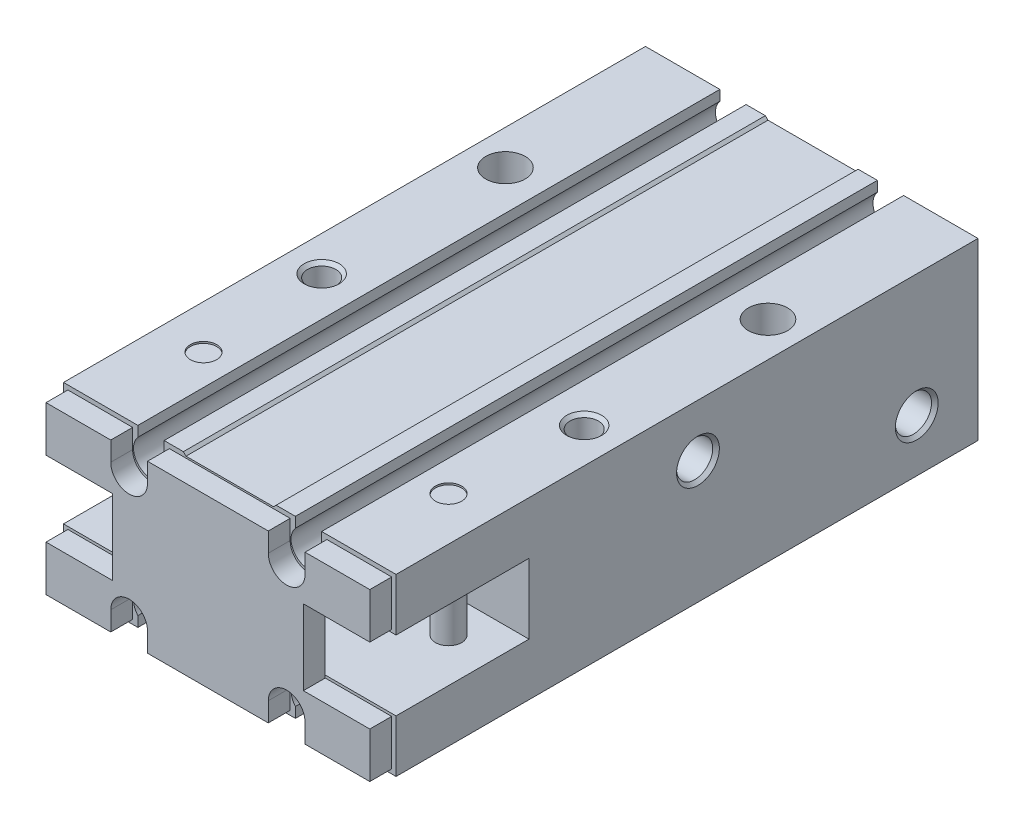
from build123d import *

# Parameters (mm, degrees)
SKETCH_1_W                  = 38
SKETCH_1_H                  = 69
EXTRUDE_1_DEPTH             = 19
CUT_EXTRUDE_1_DEPTH         = 2.5
CUT_EXTRUDE_2_REACH         = 57.533
SKETCH_4_W                  = 8.09
SKETCH_4_H                  = 8
SKETCH_5_W                  = 15.19
SKETCH_5_H                  = 8
CUT_EXTRUDE_3_DEPTH         = 7.92
SKETCH_6_W                  = 0.5
SKETCH_6_H                  = 2.5
CUT_EXTRUDE_4_DEPTH         = 75.047282192
SKETCH_7_W                  = 38
SKETCH_7_H                  = 66.5
EXTRUDE_2_DEPTH             = 0.5
SKETCH_8_W                  = 0.5
SKETCH_8_H                  = 2.5
CUT_EXTRUDE_5_DEPTH         = 73.924618614
SKETCH_9_W                  = 38
SKETCH_9_H                  = 66.5
EXTRUDE_3_DEPTH             = 0.5
SKETCH_10_W                 = 15.19
SKETCH_10_H                 = 8
CUT_EXTRUDE_6_DEPTH         = 0.5
SKETCH_11_W                 = 17.69
SKETCH_11_H                 = 8
CUT_EXTRUDE_7_DEPTH         = 7.59
SKETCH_12_W                 = 15.19
SKETCH_12_H                 = 8
CUT_EXTRUDE_8_DEPTH         = 7.92
CUT_EXTRUDE_9_REACH         = 74.983
SKETCH_13_W                 = 7.59
SKETCH_13_H                 = 2.5
SKETCH_14_W                 = 7.59
SKETCH_14_H                 = 2.5
CUT_EXTRUDE_10_DEPTH        = 0.3
CUT_EXTRUDE_11_REACH        = 74.983
SKETCH_15_W                 = 7.59
SKETCH_15_H                 = 2.5
SKETCH_16_W                 = 7.59
SKETCH_16_H                 = 2.5
CUT_EXTRUDE_12_DEPTH        = 0.3
CUT_EXTRUDE_13_DEPTH        = 2.5
CUT_EXTRUDE_14_DEPTH        = 2.5
CUT_EXTRUDE_15_DEPTH        = 2.5
CUT_EXTRUDE_16_DEPTH        = 2.5
SKETCH_21_W                 = 10
SKETCH_21_H                 = 0.3
CUT_EXTRUDE_17_DEPTH        = 70.880254722
CUT_EXTRUDE_18_DEPTH        = 70.880254722
CUT_EXTRUDE_19_DEPTH        = 73.263407061
CUT_EXTRUDE_20_DEPTH        = 73.263407061
SKETCH_25_W                 = 10
SKETCH_25_H                 = 0.3
CUT_EXTRUDE_21_DEPTH        = 66.5
CUT_EXTRUDE_22_DEPTH        = 73.263407061
CUT_EXTRUDE_23_DEPTH        = 3
DRAFT_1_ANGLE               = 45
DRAFT_2_ANGLE               = 45
SKETCH_28_W                 = 2
SKETCH_28_H                 = 66.5
SKETCH_29_W                 = 2
SKETCH_29_H                 = 66.5
SKETCH_30_W                 = 2
SKETCH_30_H                 = 66.5
SKETCH_31_W                 = 2
SKETCH_31_H                 = 66.5
SKETCH_32_W                 = 1.5
SKETCH_32_H                 = 8
SKETCH_33_W                 = 1.5
SKETCH_33_H                 = 8
HOLE_WIZARD_3_0_3_1_D       = 3
HOLE_WIZARD_3_0_3_1_DEPTH   = 0.2
HOLE_WIZARD_M3_1_D          = 3.242
HOLE_WIZARD_M3_1_DEPTH      = 8
HOLE_WIZARD_M3_1_TIP        = 0.935884786
HOLE_WIZARD_M3_2_D          = 3.242
HOLE_WIZARD_M3_2_DEPTH      = 5
HOLE_WIZARD_M3_2_TIP        = 0.935884786
HOLE_WIZARD_3_0_3_2_D       = 3
HOLE_WIZARD_3_0_3_2_DEPTH   = 0.2
HOLE_WIZARD_4_5_4_5_1_D     = 4.5
HOLE_WIZARD_M3_3_D          = 3.242
HOLE_WIZARD_M3_3_DEPTH      = 8
HOLE_WIZARD_M3_3_TIP        = 0.935884786
HOLE_WIZARD_17_0_17_1_D     = 17
HOLE_WIZARD_17_0_17_1_DEPTH = 1.5
HOLE_WIZARD_M3_4_D          = 3.242
HOLE_WIZARD_M3_4_DEPTH      = 8
HOLE_WIZARD_M3_4_TIP        = 0.935884786
HOLE_WIZARD_M3_5_1_D        = 4.134
HOLE_WIZARD_M3_5_1_DEPTH    = 5
HOLE_WIZARD_M3_5_1_TIP      = 1.193383006
CHAMFER_1_SIZE              = 0.379


with BuildPart() as part:
    # 草图1 → 凸台-拉伸1 (new body)
    with BuildSketch(Plane.XZ.offset(9.5)):
        with Locations((0, 34.5)):
            Rectangle(SKETCH_1_W, SKETCH_1_H)
    extrude(amount=-EXTRUDE_1_DEPTH)

    # 草图2 → 切除-拉伸1 (cut)
    with BuildSketch(Plane.XY.offset(69)):
        Polygon((-19, -4), (-10.91, -4), (-10.91, 4), (-18.5, 4), (-18.5, 9.5), (-19, 9.5), align=None)
    extrude(amount=-CUT_EXTRUDE_1_DEPTH, mode=Mode.SUBTRACT)

    # 草图4 → 切除-拉伸2 (cut, up to next)
    with BuildSketch(Plane(origin=(0, 0, 51.31), x_dir=(-1, 0, 0), z_dir=(0, 0, -1)), mode=Mode.PRIVATE) as cut_extrude_2_sk1:
        with Locations((14.955, 0)):
            Rectangle(SKETCH_4_W, SKETCH_4_H)
    cut_extrude_2_tool1 = extrude(cut_extrude_2_sk1.sketch, amount=-CUT_EXTRUDE_2_REACH, mode=Mode.PRIVATE) & part.part
    add(cut_extrude_2_tool1.solids().sort_by_distance((-14.955, 0, 51.31))[0], mode=Mode.SUBTRACT)

    # 草图5 → 切除-拉伸3 (cut)
    with BuildSketch(Plane.ZY.offset(10.91)):
        with Locations((58.905, 0)):
            Rectangle(SKETCH_5_W, SKETCH_5_H)
    extrude(amount=-CUT_EXTRUDE_3_DEPTH, mode=Mode.SUBTRACT)

    # 草图6 → 切除-拉伸4 (cut, through all)
    with BuildSketch(Plane.XZ.offset(9.5)):
        with Locations((18.75, 67.75)):
            Rectangle(SKETCH_6_W, SKETCH_6_H)
    extrude(amount=-CUT_EXTRUDE_4_DEPTH, mode=Mode.SUBTRACT)

    # 草图7 → 凸台-拉伸2 (add)
    with BuildSketch(Plane(origin=(0, 9.5, 0), x_dir=(-1, 0, 0), z_dir=(0, 1, 0))):
        with Locations((0, 33.25)):
            Rectangle(SKETCH_7_W, SKETCH_7_H)
    extrude(amount=EXTRUDE_2_DEPTH)

    # 草图8 → 切除-拉伸5 (cut, through all)
    with BuildSketch(Plane(origin=(0, -4, 0), x_dir=(-1, 0, 0), z_dir=(0, 1, 0))):
        with Locations((18.75, 67.75)):
            Rectangle(SKETCH_8_W, SKETCH_8_H)
    extrude(amount=-CUT_EXTRUDE_5_DEPTH, mode=Mode.SUBTRACT)

    # 草图9 → 凸台-拉伸3 (add)
    with BuildSketch(Plane.XZ.offset(9.5)):
        with Locations((0, 33.25)):
            Rectangle(SKETCH_9_W, SKETCH_9_H)
    extrude(amount=EXTRUDE_3_DEPTH)

    # 草图10 → 切除-拉伸6 (cut)
    with BuildSketch(Plane(origin=(19, 0, 0), x_dir=(0, 0, -1), z_dir=(1, 0, 0))):
        with Locations((-58.905, 0)):
            Rectangle(SKETCH_10_W, SKETCH_10_H)
    extrude(amount=-CUT_EXTRUDE_6_DEPTH, mode=Mode.SUBTRACT)

    # 草图11 → 切除-拉伸7 (cut)
    with BuildSketch(Plane(origin=(18.5, 0, 0), x_dir=(0, 0, -1), z_dir=(1, 0, 0))):
        with Locations((-60.155, 0)):
            Rectangle(SKETCH_11_W, SKETCH_11_H)
    extrude(amount=-CUT_EXTRUDE_7_DEPTH, mode=Mode.SUBTRACT)

    # 草图12 → 切除-拉伸8 (cut)
    with BuildSketch(Plane(origin=(10.91, 0, 0), x_dir=(0, 0, -1), z_dir=(1, 0, 0))):
        with Locations((-58.905, 0)):
            Rectangle(SKETCH_12_W, SKETCH_12_H)
    extrude(amount=-CUT_EXTRUDE_8_DEPTH, mode=Mode.SUBTRACT)

    # 草图13 → 切除-拉伸9 (cut, up to next)
    with BuildSketch(Plane.XZ.offset(4.3), mode=Mode.PRIVATE) as cut_extrude_9_sk1:
        with Locations((14.705, 67.75)):
            Rectangle(SKETCH_13_W, SKETCH_13_H)
    cut_extrude_9_tool1 = extrude(cut_extrude_9_sk1.sketch, amount=-CUT_EXTRUDE_9_REACH, mode=Mode.PRIVATE) & part.part
    add(cut_extrude_9_tool1.solids().sort_by_distance((14.705, -4.3, 67.75))[0], mode=Mode.SUBTRACT)

    # 草图14 → 切除-拉伸10 (cut)
    with BuildSketch(Plane(origin=(0, -4, 0), x_dir=(-1, 0, 0), z_dir=(0, 1, 0))):
        with Locations((14.705, 67.75)):
            Rectangle(SKETCH_14_W, SKETCH_14_H)
    extrude(amount=-CUT_EXTRUDE_10_DEPTH, mode=Mode.SUBTRACT)

    # 草图15 → 切除-拉伸11 (cut, up to next)
    with BuildSketch(Plane(origin=(0, 4.3, 0), x_dir=(1, 0, 0), z_dir=(0, 1, 0)), mode=Mode.PRIVATE) as cut_extrude_11_sk1:
        with Locations((-14.705, -67.75)):
            Rectangle(SKETCH_15_W, SKETCH_15_H)
    cut_extrude_11_tool1 = extrude(cut_extrude_11_sk1.sketch, amount=-CUT_EXTRUDE_11_REACH, mode=Mode.PRIVATE) & part.part
    add(cut_extrude_11_tool1.solids().sort_by_distance((-14.705, 4.3, 67.75))[0], mode=Mode.SUBTRACT)

    # 草图16 → 切除-拉伸12 (cut)
    with BuildSketch(Plane.XZ.offset(-4)):
        with Locations((14.705, 67.75)):
            Rectangle(SKETCH_16_W, SKETCH_16_H)
    extrude(amount=-CUT_EXTRUDE_12_DEPTH, mode=Mode.SUBTRACT)

    # 草图17 → 切除-拉伸13 (cut)
    with BuildSketch(Plane.XY.offset(69)):
        with BuildLine():
            Line((6.9, -7.300000198), (6.9, -9.5))
            Line((6.9, -9.5), (11.1, -9.5))
            Line((11.1, -9.5), (11.1, -7.300000198))
            ThreePointArc((11.1, -7.300000198), (9, -5.200000198), (6.9, -7.300000198))
        make_face()
    extrude(amount=-CUT_EXTRUDE_13_DEPTH, mode=Mode.SUBTRACT)

    # 草图18 → 切除-拉伸14 (cut)
    with BuildSketch(Plane.XY.offset(69)):
        with BuildLine():
            Line((-11.1, -7.300000198), (-11.1, -9.5))
            Line((-11.1, -9.5), (-6.9, -9.5))
            Line((-6.9, -9.5), (-6.9, -7.300000198))
            ThreePointArc((-6.9, -7.300000198), (-9, -5.200000198), (-11.1, -7.300000198))
        make_face()
    extrude(amount=-CUT_EXTRUDE_14_DEPTH, mode=Mode.SUBTRACT)

    # 草图19 → 切除-拉伸15 (cut)
    with BuildSketch(Plane.XY.offset(69)):
        with BuildLine():
            Line((-6.9, 9.5), (-11.1, 9.5))
            Line((-11.1, 9.5), (-11.1, 7.300000094))
            ThreePointArc((-11.1, 7.300000094), (-9, 5.200000094), (-6.9, 7.300000094))
            Line((-6.9, 7.300000094), (-6.9, 9.5))
        make_face()
    extrude(amount=-CUT_EXTRUDE_15_DEPTH, mode=Mode.SUBTRACT)

    # 草图20 → 切除-拉伸16 (cut)
    with BuildSketch(Plane.XY.offset(69)):
        with BuildLine():
            Line((11.1, 9.5), (6.9, 9.5))
            Line((6.9, 9.5), (6.9, 7.300000094))
            ThreePointArc((6.9, 7.300000094), (9, 5.200000094), (11.1, 7.300000094))
            Line((11.1, 7.300000094), (11.1, 9.5))
        make_face()
    extrude(amount=-CUT_EXTRUDE_16_DEPTH, mode=Mode.SUBTRACT)

    # 草图21 → 切除-拉伸17 (cut, through all)
    with BuildSketch(Plane.XY.offset(66.5)):
        with Locations((0, -9.85)):
            Rectangle(SKETCH_21_W, SKETCH_21_H)
    extrude(amount=-CUT_EXTRUDE_17_DEPTH, mode=Mode.SUBTRACT)

    # 草图22 → 切除-拉伸18 (cut, through all)
    with BuildSketch(Plane.XY.offset(66.5)):
        with BuildLine():
            Line((-7.5, -10), (-7.5, -8.822875656))
            ThreePointArc((-7.5, -8.822875656), (-9, -9.5), (-10.5, -8.822875656))
            Line((-10.5, -8.822875656), (-10.5, -10))
            Line((-10.5, -10), (-7.5, -10))
        make_face()
    extrude(amount=-CUT_EXTRUDE_18_DEPTH, mode=Mode.SUBTRACT)

    # 草图23 → 切除-拉伸19 (cut, through all)
    with BuildSketch(Plane(origin=(0, 0, 0), x_dir=(-1, 0, 0), z_dir=(0, 0, -1))):
        with BuildLine():
            Line((-10.5, -10), (-7.5, -10))
            Line((-7.5, -10), (-7.5, -8.822875656))
            ThreePointArc((-7.5, -8.822875656), (-9, -9.5), (-10.5, -8.822875656))
            Line((-10.5, -8.822875656), (-10.5, -10))
        make_face()
    extrude(amount=-CUT_EXTRUDE_19_DEPTH, mode=Mode.SUBTRACT)

    # 草图24 → 切除-拉伸20 (cut, through all)
    with BuildSketch(Plane(origin=(0, 0, 0), x_dir=(-1, 0, 0), z_dir=(0, 0, -1))):
        with BuildLine():
            Line((-7.5, 10), (-10.5, 10))
            Line((-10.5, 10), (-10.5, 8.822875656))
            ThreePointArc((-10.5, 8.822875656), (-9, 9.5), (-7.5, 8.822875656))
            Line((-7.5, 8.822875656), (-7.5, 10))
        make_face()
    extrude(amount=-CUT_EXTRUDE_20_DEPTH, mode=Mode.SUBTRACT)

    # 草图25 → 切除-拉伸21 (cut)
    with BuildSketch(Plane(origin=(0, 0, 0), x_dir=(-1, 0, 0), z_dir=(0, 0, -1))):
        with Locations((0, 9.85)):
            Rectangle(SKETCH_25_W, SKETCH_25_H)
    extrude(amount=-CUT_EXTRUDE_21_DEPTH, mode=Mode.SUBTRACT)

    # 草图26 → 切除-拉伸22 (cut, through all)
    with BuildSketch(Plane(origin=(0, 0, 0), x_dir=(-1, 0, 0), z_dir=(0, 0, -1))):
        with BuildLine():
            Line((10.5, 10), (7.5, 10))
            Line((7.5, 10), (7.5, 8.822875656))
            ThreePointArc((7.5, 8.822875656), (9, 9.5), (10.5, 8.822875656))
            Line((10.5, 8.822875656), (10.5, 10))
        make_face()
    extrude(amount=-CUT_EXTRUDE_22_DEPTH, mode=Mode.SUBTRACT)

    # 草图27 → 切除-拉伸23 (cut)
    with BuildSketch(Plane(origin=(0, 0, 0), x_dir=(-1, 0, 0), z_dir=(0, 0, -1))):
        with BuildLine():
            Line((-14.5, 1.5), (-15.5, 1.5))
            ThreePointArc((-15.5, 1.5), (-17, 0), (-15.5, -1.5))
            Line((-15.5, -1.5), (-14.5, -1.5))
            ThreePointArc((-14.5, -1.5), (-13, 0), (-14.5, 1.5))
        make_face()
    extrude(amount=-CUT_EXTRUDE_23_DEPTH, mode=Mode.SUBTRACT)

    # 拔模1
    draft_1_faces = [part.faces().sort_by_distance(p)[0] for p in [
        (5, -9.85, 33.25),
        (-5, -9.85, 33.25),
    ]]
    draft(draft_1_faces, Plane(origin=(5, -9.7, 0), x_dir=(0, 0, -1), z_dir=(0, -1, 0)), DRAFT_1_ANGLE)

    # 拔模2
    draft_2_faces = [part.faces().sort_by_distance(p)[0] for p in [
        (-5, 9.85, 33.25),
        (5, 9.85, 33.25),
    ]]
    draft(draft_2_faces, Plane(origin=(5, 9.7, 66.5), x_dir=(0, 0, 1), z_dir=(0, 1, 0)), DRAFT_2_ANGLE)

    # 草图28 → 切除-旋转1 (revolve, cut)
    with BuildSketch(Plane(origin=(0, -7.5, 0), x_dir=(1, 0, 0), z_dir=(0, 1, 0))):
        with Locations((10, -33.25)):
            Rectangle(SKETCH_28_W, SKETCH_28_H)
    revolve(axis=Axis((9, -7.5, 0), (0, 0, 1)), mode=Mode.SUBTRACT)

    # 草图29 → 切除-旋转2 (revolve, cut)
    with BuildSketch(Plane(origin=(0, -7.5, 0), x_dir=(1, 0, 0), z_dir=(0, 1, 0))):
        with Locations((-8, -33.25)):
            Rectangle(SKETCH_29_W, SKETCH_29_H)
    revolve(axis=Axis((-9, -7.5, 0), (0, 0, 1)), mode=Mode.SUBTRACT)

    # 草图30 → 切除-旋转3 (revolve, cut)
    with BuildSketch(Plane(origin=(0, 7.5, 0), x_dir=(1, 0, 0), z_dir=(0, 1, 0))):
        with Locations((-8, -33.25)):
            Rectangle(SKETCH_30_W, SKETCH_30_H)
    revolve(axis=Axis((-9, 7.5, 0), (0, 0, 1)), mode=Mode.SUBTRACT)

    # 草图31 → 切除-旋转4 (revolve, cut)
    with BuildSketch(Plane(origin=(0, 7.5, 0), x_dir=(1, 0, 0), z_dir=(0, 1, 0))):
        with Locations((10, -33.25)):
            Rectangle(SKETCH_31_W, SKETCH_31_H)
    revolve(axis=Axis((9, 7.5, 0), (0, 0, 1)), mode=Mode.SUBTRACT)

    # 草图32 → 旋转1 (revolve)
    with BuildSketch(Plane.XY.offset(55.5), mode=Mode.PRIVATE) as revolve_1_sk:
        with Locations((14.75, 0)):
            Rectangle(SKETCH_32_W, SKETCH_32_H)
    revolve(revolve_1_sk.sketch.rotate(Axis((14, 4, 55.5), (0, -1, 0)), 270), axis=Axis((14, 4, 55.5), (0, -1, 0)))

    # 草图33 → 旋转2 (revolve)
    with BuildSketch(Plane.XY.offset(55.5), mode=Mode.PRIVATE) as revolve_2_sk:
        with Locations((-13.25, 0)):
            Rectangle(SKETCH_33_W, SKETCH_33_H)
    revolve(revolve_2_sk.sketch.rotate(Axis((-14, 4, 55.5), (0, -1, 0)), 270), axis=Axis((-14, 4, 55.5), (0, -1, 0)))

    # Ø3.0 (3) 直径孔1
    with Locations(Plane(origin=(0, 10, 0), x_dir=(1, 0, 0), z_dir=(0, 1, 0))):
        with Locations((-14, -55.5), (14, -55.5)):
            Hole(HOLE_WIZARD_3_0_3_1_D / 2, depth=HOLE_WIZARD_3_0_3_1_DEPTH)

    # M3 间隙孔1
    with Locations(Plane(origin=(0, 10, 0), x_dir=(1, 0, 0), z_dir=(0, 1, 0))):
        with Locations((-15, -41), (15, -41)):
            Hole(HOLE_WIZARD_M3_1_D / 2, depth=HOLE_WIZARD_M3_1_DEPTH)
            with Locations((0, 0, -(HOLE_WIZARD_M3_1_DEPTH + HOLE_WIZARD_M3_1_TIP / 2))):  # 120° drill point
                Cone(0, HOLE_WIZARD_M3_1_D / 2, HOLE_WIZARD_M3_1_TIP, mode=Mode.SUBTRACT)

    # M3 间隙孔2
    with Locations(Plane.ZY.offset(19)):
        with Locations((33, 6), (33, -6)):
            Hole(HOLE_WIZARD_M3_2_D / 2, depth=HOLE_WIZARD_M3_2_DEPTH)
            with Locations((0, 0, -(HOLE_WIZARD_M3_2_DEPTH + HOLE_WIZARD_M3_2_TIP / 2))):  # 120° drill point
                Cone(0, HOLE_WIZARD_M3_2_D / 2, HOLE_WIZARD_M3_2_TIP, mode=Mode.SUBTRACT)

    # Ø3.0 (3) 直径孔2
    with Locations(Plane(origin=(0, -10, 0), x_dir=(-1, 0, 0), z_dir=(0, -1, 0))):
        with Locations((-14, -55.5), (14, -55.5)):
            Hole(HOLE_WIZARD_3_0_3_2_D / 2, depth=HOLE_WIZARD_3_0_3_2_DEPTH)

    # Ø4.5 (4.5) 直径孔1 (through all)
    with Locations(Plane(origin=(0, 10, 0), x_dir=(1, 0, 0), z_dir=(0, 1, 0))):
        with Locations((15, -20), (-15, -20)):
            Hole(HOLE_WIZARD_4_5_4_5_1_D / 2)

    # M3 间隙孔3
    with Locations(Plane(origin=(0, -10, 0), x_dir=(-1, 0, 0), z_dir=(0, -1, 0))):
        with Locations((-15, -41), (15, -41)):
            Hole(HOLE_WIZARD_M3_3_D / 2, depth=HOLE_WIZARD_M3_3_DEPTH)
            with Locations((0, 0, -(HOLE_WIZARD_M3_3_DEPTH + HOLE_WIZARD_M3_3_TIP / 2))):  # 120° drill point
                Cone(0, HOLE_WIZARD_M3_3_D / 2, HOLE_WIZARD_M3_3_TIP, mode=Mode.SUBTRACT)

    # Ø17.0 (17) 直径孔1
    with Locations(Plane(origin=(0, 0, 0), x_dir=(-1, 0, 0), z_dir=(0, 0, -1))):
        with Locations((0, 0)):
            Hole(HOLE_WIZARD_17_0_17_1_D / 2, depth=HOLE_WIZARD_17_0_17_1_DEPTH)

    # M3 间隙孔4
    with Locations(Plane(origin=(0, 0, 0), x_dir=(-1, 0, 0), z_dir=(0, 0, -1))):
        with Locations((15, -6), (-15, 6)):
            Hole(HOLE_WIZARD_M3_4_D / 2, depth=HOLE_WIZARD_M3_4_DEPTH)
            with Locations((0, 0, -(HOLE_WIZARD_M3_4_DEPTH + HOLE_WIZARD_M3_4_TIP / 2))):  # 120° drill point
                Cone(0, HOLE_WIZARD_M3_4_D / 2, HOLE_WIZARD_M3_4_TIP, mode=Mode.SUBTRACT)

    # M3.5 间隙孔1
    with Locations(Plane(origin=(19, 0, 0), x_dir=(0, 0, -1), z_dir=(1, 0, 0))):
        with Locations((-7, -4), (-32, 4)):
            Hole(HOLE_WIZARD_M3_5_1_D / 2, depth=HOLE_WIZARD_M3_5_1_DEPTH)
            with Locations((0, 0, -(HOLE_WIZARD_M3_5_1_DEPTH + HOLE_WIZARD_M3_5_1_TIP / 2))):  # 120° drill point
                Cone(0, HOLE_WIZARD_M3_5_1_D / 2, HOLE_WIZARD_M3_5_1_TIP, mode=Mode.SUBTRACT)

    # 倒角1
    chamfer_1_edges = [part.edges().sort_by_distance(p)[0] for p in [
        (16.621, 10, 41),
        (-13.379, 10, 41),
        (-19, -6, 34.621),
        (-19, 6, 34.621),
        (-16.621, -10, 41),
        (13.379, -10, 41),
        (13.379, 6, 0),
        (-16.621, -6, 0),
        (19, 4, 29.933),
        (19, -4, 4.933),
    ]]
    chamfer(chamfer_1_edges, length=CHAMFER_1_SIZE)


solid = part.part
